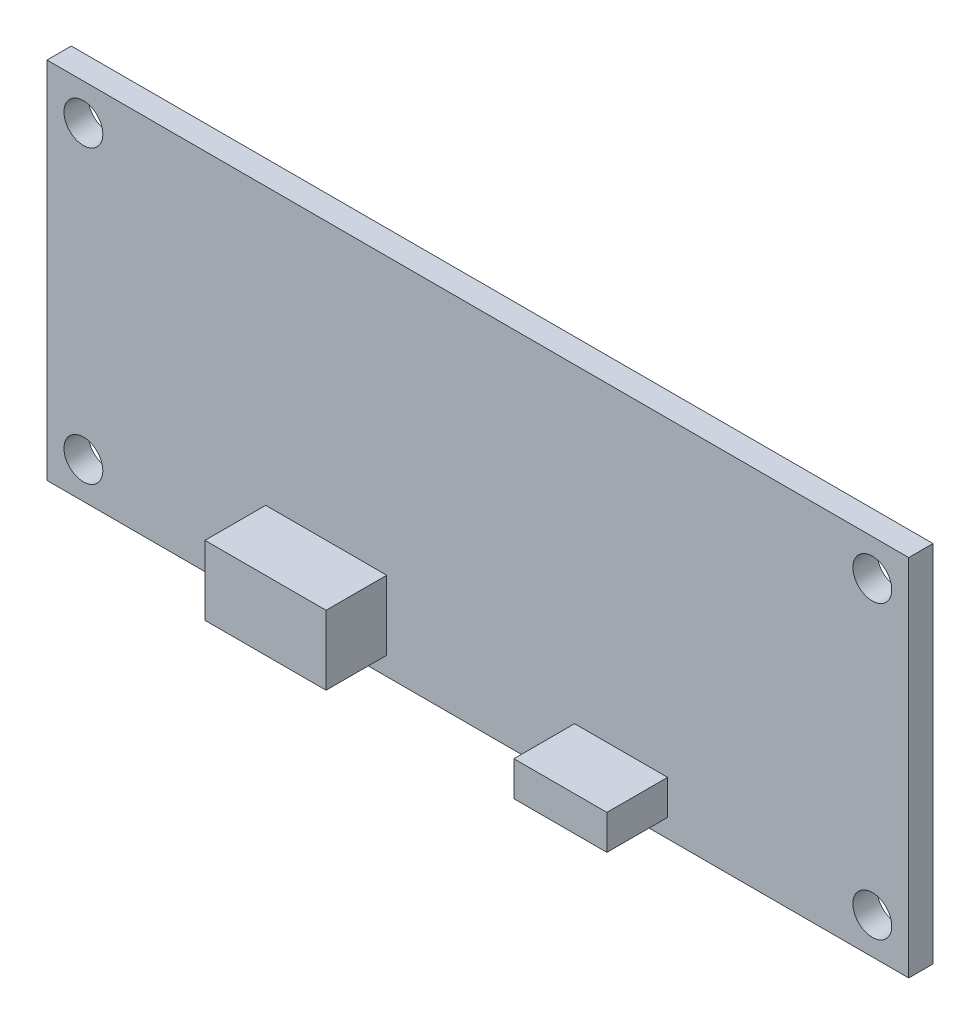
from build123d import *

# Parameters (mm, degrees)
SKETCH_1_W      = 71
SKETCH_1_H      = 30
SKETCH_1_R      = 1.6
EXTRUDE_1_DEPTH = 2
SKETCH_2_W      = 9.975674075
SKETCH_2_H      = 5.707731043
SKETCH_2_W_2    = 7.661729058
SKETCH_2_H_2    = 2.853865522
EXTRUDE_2_DEPTH = 5


with BuildPart() as part:
    # 草图1 → 凸台-拉伸1 (new body)
    with BuildSketch(Plane.XY):
        with Locations((35.5, 15)):
            Rectangle(SKETCH_1_W, SKETCH_1_H)
        with Locations((3, 27)):
            Circle(SKETCH_1_R, mode=Mode.SUBTRACT)
        with Locations((68, 3)):
            Circle(SKETCH_1_R, mode=Mode.SUBTRACT)
        with Locations((3, 3)):
            Circle(SKETCH_1_R, mode=Mode.SUBTRACT)
        with Locations((68, 27)):
            Circle(SKETCH_1_R, mode=Mode.SUBTRACT)
    extrude(amount=EXTRUDE_1_DEPTH)

    # 草图2 → 凸台-拉伸2 (add)
    with BuildSketch(Plane.XY.offset(2)):
        with Locations((23.004696906, 4.381563419)):
            Rectangle(SKETCH_2_W, SKETCH_2_H)
        with Locations((47.301119589, 2.954630659)):
            Rectangle(SKETCH_2_W_2, SKETCH_2_H_2)
    extrude(amount=EXTRUDE_2_DEPTH)


solid = part.part
